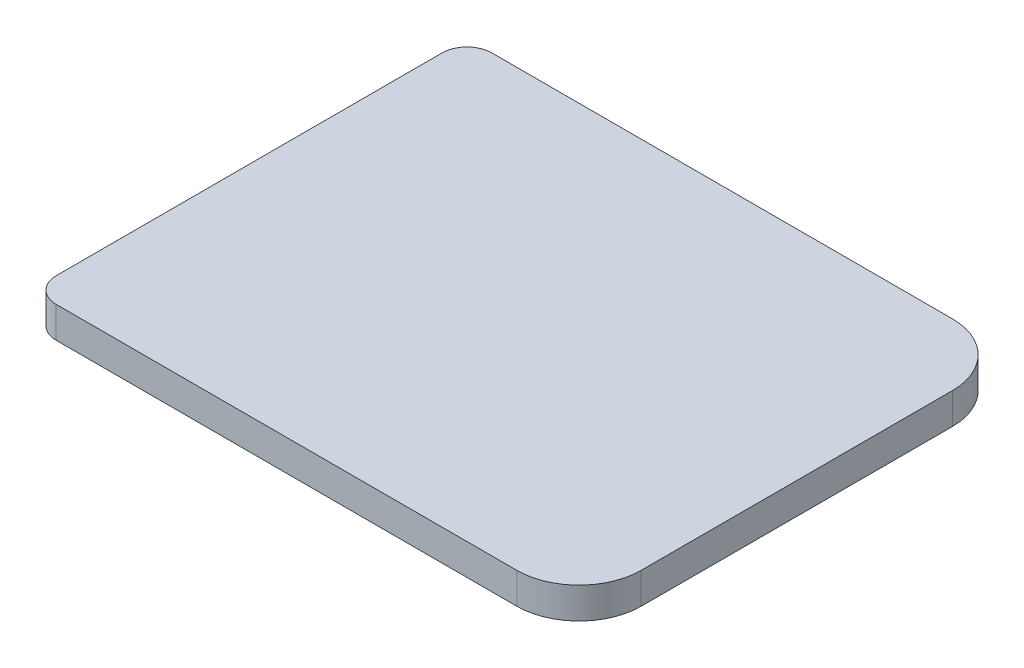
from build123d import *

# Parameters (mm, degrees)
BOSS_EXTRUDE1_DEPTH = 1.5875


with BuildPart() as part:
    # Sketch1 → Boss-Extrude1 (new body)
    with BuildSketch(Plane(origin=(0, 0, 0), x_dir=(1, 0, 0), z_dir=(0, 1, 0))):
        with BuildLine():
            Line((1.27, 0), (24.765, 0))
            ThreePointArc((24.765, 0), (27.01006403, 0.92993597), (27.94, 3.175))
            Line((27.94, 3.175), (27.94, 19.05))
            ThreePointArc((27.94, 19.05), (27.01006403, 21.29506403), (24.765, 22.225))
            Line((24.765, 22.225), (1.27, 22.225))
            ThreePointArc((1.27, 22.225), (0.371974388, 21.853025612), (0, 20.955))
            Line((0, 20.955), (0, 1.27))
            ThreePointArc((0, 1.27), (0.371974388, 0.371974388), (1.27, 0))
        make_face()
    extrude(amount=BOSS_EXTRUDE1_DEPTH)


solid = part.part
